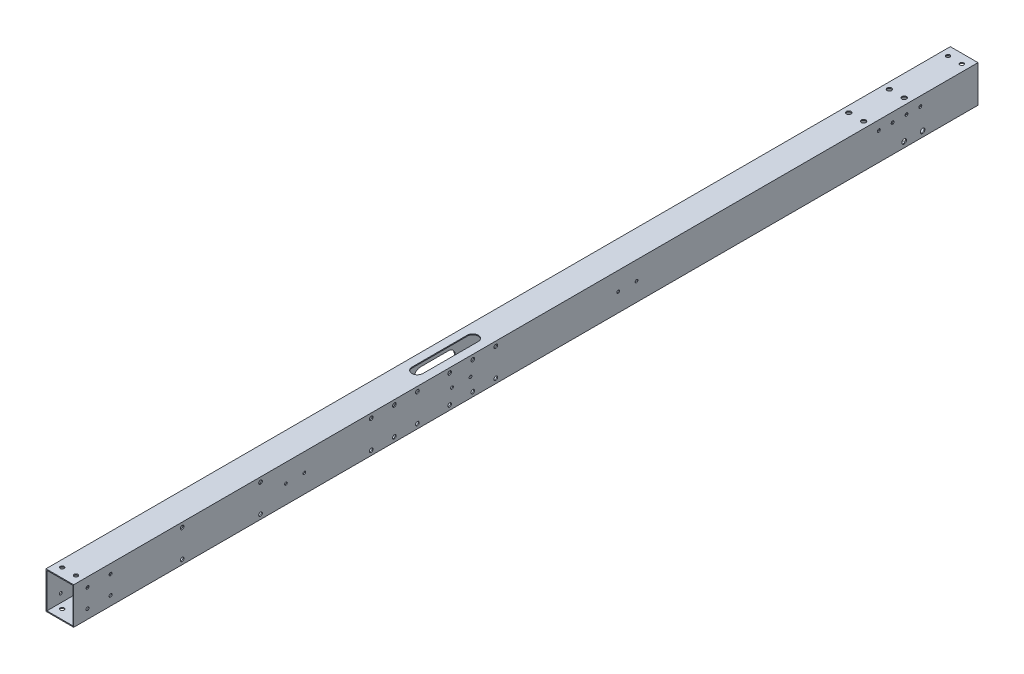
from build123d import *

# Parameters (mm, degrees)
SKETCH_1_W           = 30
SKETCH_1_H           = 40
SKETCH_1_W_2         = 28
SKETCH_1_H_2         = 38
EXTRUDE_1_DEPTH      = 940
SKETCH_5_R           = 2.5
CUT_EXTRUDE_3_DEPTH  = 941.97024395
CUT_EXTRUDE_4_DEPTH  = 1
SKETCH_7_R           = 1.5
CUT_EXTRUDE_5_DEPTH  = 1
SKETCH_17_W          = 30
SKETCH_17_H          = 40
SKETCH_17_W_2        = 28
SKETCH_17_H_2        = 38
EXTRUDE_2_DEPTH      = 20
SKETCH_18_W          = 30
SKETCH_18_H          = 40
SKETCH_18_W_2        = 28
SKETCH_18_H_2        = 38
EXTRUDE_3_DEPTH      = 20
SKETCH_19_R          = 2.1
CUT_EXTRUDE_16_DEPTH = 961.950050731
SKETCH_20_R          = 1.6
CUT_EXTRUDE_17_DEPTH = 961.67684473
SKETCH_21_R          = 2.5
SKETCH_21_R_2        = 1.6
CUT_EXTRUDE_18_DEPTH = 961.67684473
SKETCH_23_R          = 2.5
CUT_EXTRUDE_19_DEPTH = 961.950050731
SKETCH_24_R          = 4.5
CUT_EXTRUDE_20_DEPTH = 10
SKETCH_25_W          = 114.67616049
SKETCH_25_H          = 1154.562704257
CUT_EXTRUDE_21_DEPTH = 968.690549711
SKETCH_26_R          = 2
CUT_EXTRUDE_22_DEPTH = 961.67684473
CUT_EXTRUDE_23_DEPTH = 10


with BuildPart() as part:
    # 草图1 → 凸台-拉伸1 (new body)
    with BuildSketch(Plane.XY):
        Rectangle(SKETCH_1_W, SKETCH_1_H)
        Rectangle(SKETCH_1_W_2, SKETCH_1_H_2, mode=Mode.SUBTRACT)
    extrude(amount=EXTRUDE_1_DEPTH)

    # 草图5 → 切除-拉伸3 (cut, through all)
    with BuildSketch(Plane.XZ.offset(20)):
        with Locations((-8, 53)):
            Circle(SKETCH_5_R)
        with Locations((8, 53)):
            Circle(SKETCH_5_R)
        with Locations((-8, 97)):
            Circle(SKETCH_5_R)
        with Locations((8, 97)):
            Circle(SKETCH_5_R)
    extrude(amount=-CUT_EXTRUDE_3_DEPTH, mode=Mode.SUBTRACT)

    # 草图6 → 切除-拉伸4 (cut)
    with BuildSketch(Plane(origin=(15, 0, 0), x_dir=(0, 0, -1), z_dir=(1, 0, 0))):
        with BuildLine():
            Line((-345, -7.5), (-375, -7.5))
            ThreePointArc((-375, -7.5), (-382.5, 0), (-375, 7.5))
            Line((-375, 7.5), (-345, 7.5))
            ThreePointArc((-345, 7.5), (-337.5, 0), (-345, -7.5))
        make_face()
        with BuildLine():
            Line((-525, -7.5), (-555, -7.5))
            ThreePointArc((-555, -7.5), (-562.5, 0), (-555, 7.5))
            Line((-555, 7.5), (-525, 7.5))
            ThreePointArc((-525, 7.5), (-517.5, 0), (-525, -7.5))
        make_face()
        with BuildLine():
            Line((-705, -7.5), (-735, -7.5))
            ThreePointArc((-735, -7.5), (-742.5, 0), (-735, 7.5))
            Line((-735, 7.5), (-705, 7.5))
            ThreePointArc((-705, 7.5), (-697.5, 0), (-705, -7.5))
        make_face()
    extrude(amount=-CUT_EXTRUDE_4_DEPTH, mode=Mode.SUBTRACT)

    # 草图7 → 切除-拉伸5 (cut)
    with BuildSketch(Plane.ZY.offset(15)):
        with Locations((350, 0)):
            Circle(SKETCH_7_R)
        with Locations((370, 0)):
            Circle(SKETCH_7_R)
        with Locations((530, 0)):
            Circle(SKETCH_7_R)
        with Locations((550, 0)):
            Circle(SKETCH_7_R)
        with Locations((710, 0)):
            Circle(SKETCH_7_R)
        with Locations((730, 0)):
            Circle(SKETCH_7_R)
    extrude(amount=-CUT_EXTRUDE_5_DEPTH, mode=Mode.SUBTRACT)

    # 草图17 → 凸台-拉伸2 (add)
    with BuildSketch(Plane.XY.offset(940)):
        Rectangle(SKETCH_17_W, SKETCH_17_H)
        Rectangle(SKETCH_17_W_2, SKETCH_17_H_2, mode=Mode.SUBTRACT)
    extrude(amount=EXTRUDE_2_DEPTH)

    # 草图18 → 凸台-拉伸3 (add)
    with BuildSketch(Plane(origin=(0, 0, 0), x_dir=(-1, 0, 0), z_dir=(0, 0, -1))):
        Rectangle(SKETCH_18_W, SKETCH_18_H)
        Rectangle(SKETCH_18_W_2, SKETCH_18_H_2, mode=Mode.SUBTRACT)
    extrude(amount=EXTRUDE_3_DEPTH)

    # 草图19 → 切除-拉伸16 (cut, through all)
    with BuildSketch(Plane(origin=(0, 20, 0), x_dir=(1, 0, 0), z_dir=(0, 1, 0))):
        with Locations((-7.5, -950)):
            Circle(SKETCH_19_R)
        with Locations((7.5, -950)):
            Circle(SKETCH_19_R)
        with Locations((-7.5, 10)):
            Circle(SKETCH_19_R)
        with Locations((7.5, 10)):
            Circle(SKETCH_19_R)
    extrude(amount=-CUT_EXTRUDE_16_DEPTH, mode=Mode.SUBTRACT)

    # 草图20 → 切除-拉伸17 (cut, through all)
    with BuildSketch(Plane(origin=(15, 0, 0), x_dir=(0, 0, -1), z_dir=(1, 0, 0))):
        with Locations((-945, 10)):
            Circle(SKETCH_20_R)
        with Locations((-920, 10)):
            Circle(SKETCH_20_R)
        with Locations((-920, -10)):
            Circle(SKETCH_20_R)
        with Locations((-945, -10)):
            Circle(SKETCH_20_R)
    extrude(amount=-CUT_EXTRUDE_17_DEPTH, mode=Mode.SUBTRACT)

    # 草图21 → 切除-拉伸18 (cut, through all)
    with BuildSketch(Plane(origin=(15, 0, 0), x_dir=(0, 0, -1), z_dir=(1, 0, 0))):
        with Locations((-40, -14)):
            Circle(SKETCH_21_R)
        with Locations((-60, -14)):
            Circle(SKETCH_21_R)
        with Locations((-42.5, 10)):
            Circle(SKETCH_21_R_2)
        with Locations((-57.5, 10)):
            Circle(SKETCH_21_R_2)
        with Locations((-72.5, 10)):
            Circle(SKETCH_21_R_2)
        with Locations((-87.5, 10)):
            Circle(SKETCH_21_R_2)
    extrude(amount=-CUT_EXTRUDE_18_DEPTH, mode=Mode.SUBTRACT)

    # 草图23 → 切除-拉伸19 (cut, through all)
    with BuildSketch(Plane(origin=(0, 20, 0), x_dir=(1, 0, 0), z_dir=(0, 1, 0))):
        with Locations((0, -520)):
            Circle(SKETCH_23_R)
        with Locations((0, -535)):
            Circle(SKETCH_23_R)
        with Locations((0, -550)):
            Circle(SKETCH_23_R)
        with Locations((0, -565)):
            Circle(SKETCH_23_R)
    extrude(amount=-CUT_EXTRUDE_19_DEPTH, mode=Mode.SUBTRACT)

    # 草图24 → 切除-拉伸20 (cut)
    with BuildSketch(Plane(origin=(0, 20, 0), x_dir=(1, 0, 0), z_dir=(0, 1, 0))):
        with Locations((0, -520)):
            Circle(SKETCH_24_R)
        with Locations((0, -535)):
            Circle(SKETCH_24_R)
        with Locations((0, -550)):
            Circle(SKETCH_24_R)
        with Locations((0, -565)):
            Circle(SKETCH_24_R)
    extrude(amount=-CUT_EXTRUDE_20_DEPTH, mode=Mode.SUBTRACT)


with BuildPart() as body_2:
    # 镜向2: mirrored copy
    add(part.part.mirror(Plane(origin=(-50, 0, 0), x_dir=(0, 0, 1), z_dir=(1, 0, 0))))

    # 草图26 → 切除-拉伸22 (cut, through all)
    with BuildSketch(Plane.ZY.offset(115)):
        with Locations((612.5, 15)):
            Circle(SKETCH_26_R)
        with Locations((612.5, -15)):
            Circle(SKETCH_26_R)
        with Locations((527.5, 15)):
            Circle(SKETCH_26_R)
        with Locations((527.5, -15)):
            Circle(SKETCH_26_R)
        with Locations((842.5, 15)):
            Circle(SKETCH_26_R)
        with Locations((842.5, -15)):
            Circle(SKETCH_26_R)
        with Locations((757.5, 15)):
            Circle(SKETCH_26_R)
        with Locations((757.5, -15)):
            Circle(SKETCH_26_R)
        with Locations((637.5, 15)):
            Circle(SKETCH_26_R)
        with Locations((637.5, -15)):
            Circle(SKETCH_26_R)
        with Locations((552.5, -15)):
            Circle(SKETCH_26_R)
        with Locations((552.5, 15)):
            Circle(SKETCH_26_R)
        with Locations((502.5, 15)):
            Circle(SKETCH_26_R)
        with Locations((502.5, -15)):
            Circle(SKETCH_26_R)
        with Locations((587.5, -15)):
            Circle(SKETCH_26_R)
        with Locations((587.5, 15)):
            Circle(SKETCH_26_R)
    extrude(amount=-CUT_EXTRUDE_22_DEPTH, mode=Mode.SUBTRACT)

    # 草图27 → 切除-拉伸23 (cut)
    with BuildSketch(Plane(origin=(0, 20, 0), x_dir=(1, 0, 0), z_dir=(0, 1, 0))):
        with BuildLine():
            Line((-94, -512.5), (-94, -572.5))
            ThreePointArc((-94, -572.5), (-100, -578.5), (-106, -572.5))
            Line((-106, -572.5), (-106, -512.5))
            ThreePointArc((-106, -512.5), (-100, -506.5), (-94, -512.5))
        make_face()
    extrude(amount=-CUT_EXTRUDE_23_DEPTH, mode=Mode.SUBTRACT)


with BuildPart() as part_1:
    add(part.part)

    # 草图25 → 切除-拉伸21 (cut, through all)
    with BuildSketch(Plane(origin=(0, 20, 0), x_dir=(1, 0, 0), z_dir=(0, 1, 0))):
        with Locations((7.338080245, -506.215166959)):
            Rectangle(SKETCH_25_W, SKETCH_25_H)
    extrude(amount=-CUT_EXTRUDE_21_DEPTH, mode=Mode.SUBTRACT)


solid = body_2.part
